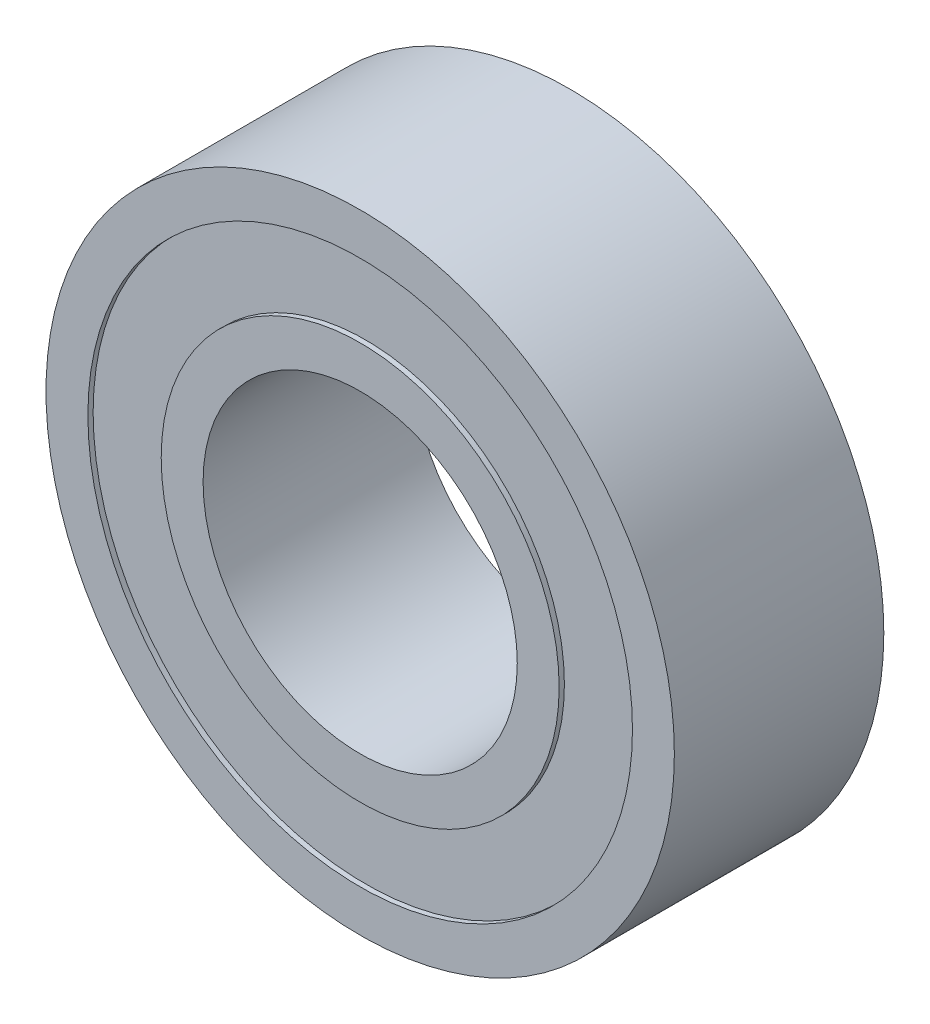
from build123d import *

# Parameters (mm, degrees)
SKETCH1_R           = 6
SKETCH1_R_2         = 3
BOSS_EXTRUDE1_DEPTH = 2
SKETCH2_R           = 5.2
SKETCH2_R_2         = 3.8
CUT_EXTRUDE1_DEPTH  = 0.1


with BuildPart() as part:
    # Sketch1 → Boss-Extrude1 (new, symmetric)
    with BuildSketch(Plane.XY):
        Circle(SKETCH1_R)
        Circle(SKETCH1_R_2, mode=Mode.SUBTRACT)
    extrude(amount=BOSS_EXTRUDE1_DEPTH, both=True)

    # Sketch2 → Cut-Extrude1 (cut)
    with BuildSketch(Plane.XY.offset(2)):
        Circle(SKETCH2_R)
        Circle(SKETCH2_R_2, mode=Mode.SUBTRACT)
    cut_extrude1 = extrude(amount=-CUT_EXTRUDE1_DEPTH, mode=Mode.SUBTRACT)

    # Mirror1: Cut-Extrude1 across plane
    add(cut_extrude1.mirror(Plane.XY), mode=Mode.SUBTRACT)


solid = part.part
